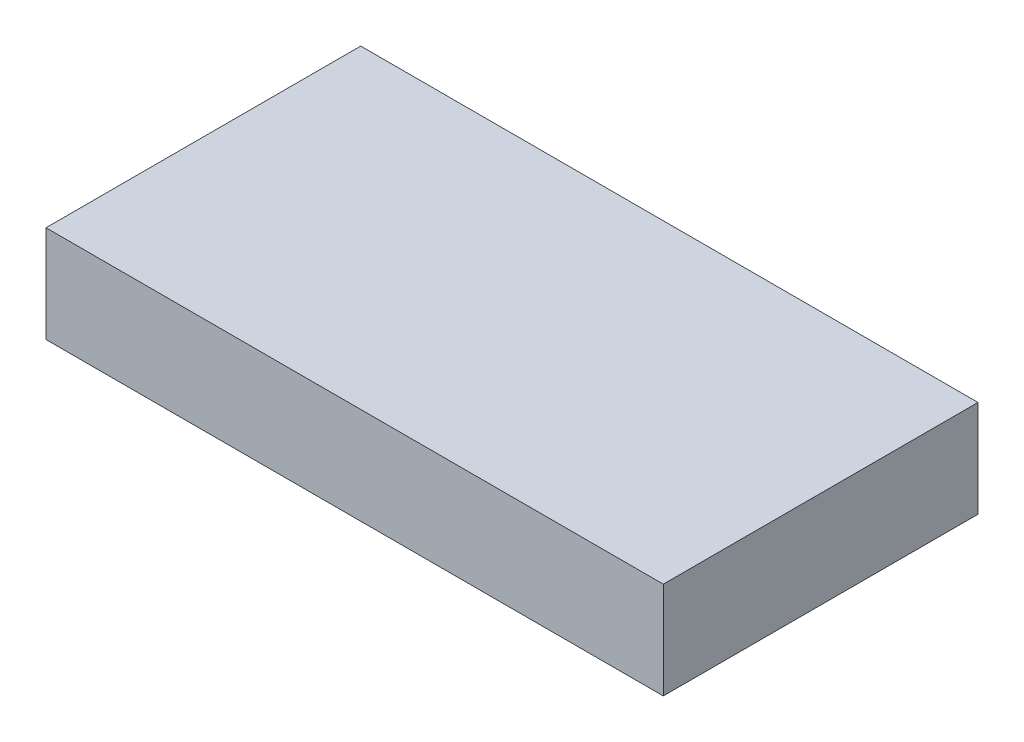
from build123d import *

# Parameters (mm, degrees)
SKETCH_1_W      = 51
SKETCH_1_H      = 26
EXTRUDE_1_DEPTH = 8


with BuildPart() as part:
    # 草图1 → 凸台-拉伸1 (new body)
    with BuildSketch(Plane(origin=(0, 0, 0), x_dir=(1, 0, 0), z_dir=(0, 1, 0))):
        with Locations((25.5, -13)):
            Rectangle(SKETCH_1_W, SKETCH_1_H)
    extrude(amount=EXTRUDE_1_DEPTH)


solid = part.part
